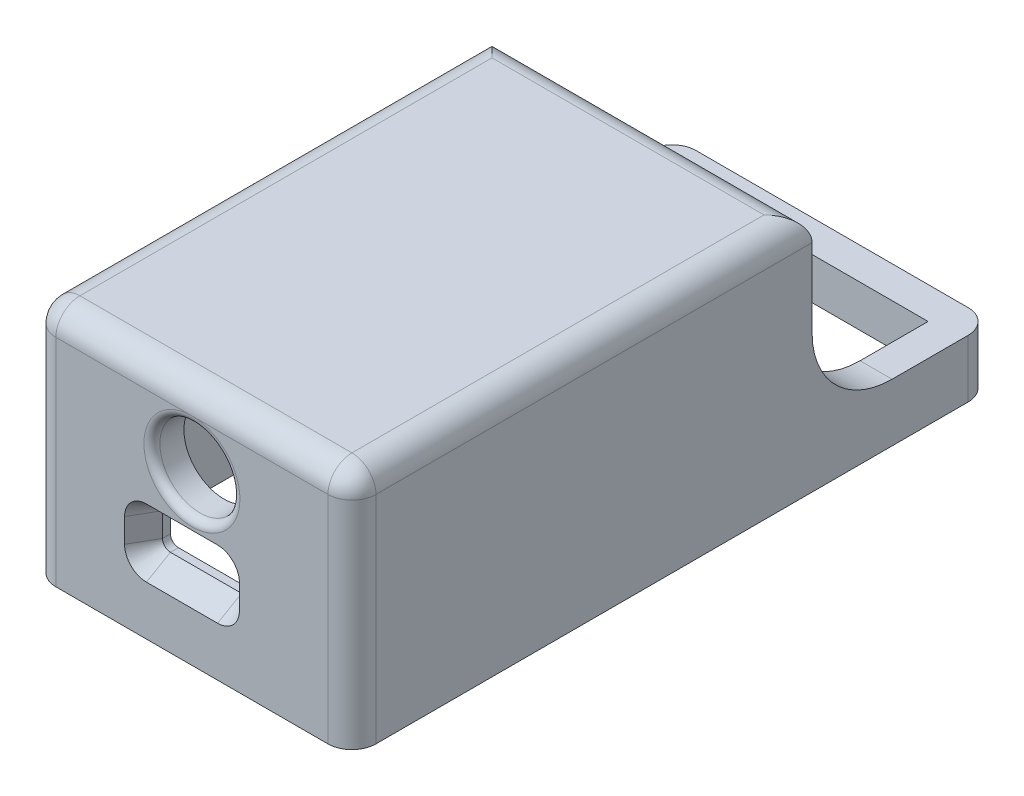
from build123d import *
from OCP.BRepFilletAPI import BRepFilletAPI_MakeChamfer

# Parameters (mm, degrees)
SKETCH1_W           = 40
SKETCH1_H           = 30.000000000000004
BOSS_EXTRUDE1_DEPTH = 80
SHELL1_T            = -4
SKETCH2_W           = 10.889999999999999
SKETCH2_H           = 5
CUT_EXTRUDE1_DEPTH  = 91.97252332435328
FILLET1_R           = 1
CHAMFER1_SIZE       = 3
CHAMFER1_SIZE2      = 1.732050807568882
CUT_EXTRUDE2_DEPTH  = 95.33981132056604
SKETCH4_R           = 5.000000000000001
CUT_EXTRUDE3_DEPTH  = 5
FILLET2_R           = 1
FILLET3_R           = 10
FILLET4_R           = 3
CUT_EXTRUDE4_DEPTH  = 2


with BuildPart() as part:
    # Sketch1 → Boss-Extrude1 (new body)
    with BuildSketch(Plane.XY):
        with Locations((20, 15.000000000000002)):
            Rectangle(SKETCH1_W, SKETCH1_H)
    extrude(amount=BOSS_EXTRUDE1_DEPTH)

    # Shell1
    shell1_openings = [part.faces().sort_by_distance(p)[0] for p in [
        (20, 0, 40),
    ]]
    offset(amount=SHELL1_T, openings=shell1_openings, kind=Kind.INTERSECTION)

    # Sketch2 → Cut-Extrude1 (cut, through all)
    with BuildSketch(Plane(origin=(0, 0, 76), x_dir=(-1, 0, 0), z_dir=(0, 0, -1))):
        with Locations((-18.76162487822802, 10.397683125280034)):
            Rectangle(SKETCH2_W, SKETCH2_H)
    extrude(amount=-CUT_EXTRUDE1_DEPTH, mode=Mode.SUBTRACT)

    # Fillet1
    fillet1_edges = [part.edges().sort_by_distance(p)[0] for p in [
        (13.316624878228021, 12.897683125280034, 78),
        (13.316624878228021, 7.897683125280034, 78),
        (24.206624878228023, 7.897683125280034, 78),
        (24.206624878228023, 12.897683125280034, 78),
    ]]
    fillet(fillet1_edges, radius=FILLET1_R)

    # Chamfer1: one chamfer whose edges measure the first distance from different faces: ONE call of the kernel's chamfer builder (chamfer() names one face for all edges)
    chamfer1_edges_1 = [part.edges().sort_by_distance(p)[0] for p in [
        (13.316624878228021, 10.397683125280034, 80),
    ]]
    chamfer1_side_1 = [part.faces().sort_by_distance(p)[0] for p in [
        (13.316624878228021, 10.397683125280034, 78),
    ]]
    chamfer1_edges_2 = [part.edges().sort_by_distance(p)[0] for p in [
        (18.761624878228023, 7.897683125280034, 80),
    ]]
    chamfer1_side_2 = [part.faces().sort_by_distance(p)[0] for p in [
        (18.761624878228023, 7.897683125280035, 78),
    ]]
    chamfer1_edges_3 = [part.edges().sort_by_distance(p)[0] for p in [
        (18.761624878228023, 12.897683125280034, 80),
    ]]
    chamfer1_side_3 = [part.faces().sort_by_distance(p)[0] for p in [
        (18.761624878228023, 12.897683125280034, 78),
    ]]
    chamfer1_edges_4 = [part.edges().sort_by_distance(p)[0] for p in [
        (24.206624878228023, 10.397683125280034, 80),
    ]]
    chamfer1_side_4 = [part.faces().sort_by_distance(p)[0] for p in [
        (24.206624878228023, 10.397683125280034, 78),
    ]]
    chamfer1_edges_5 = [part.edges().sort_by_distance(p)[0] for p in [
        (13.609518097041473, 8.190576344093486, 80),
    ]]
    chamfer1_side_5 = [part.faces().sort_by_distance(p)[0] for p in [
        (13.609518097041473, 8.190576344093486, 78),
    ]]
    chamfer1_edges_6 = [part.edges().sort_by_distance(p)[0] for p in [
        (13.609518097041473, 12.604789906466582, 80),
    ]]
    chamfer1_side_6 = [part.faces().sort_by_distance(p)[0] for p in [
        (13.609518097041473, 12.604789906466582, 78),
    ]]
    chamfer1_edges_7 = [part.edges().sort_by_distance(p)[0] for p in [
        (23.91373165941457, 8.190576344093486, 80),
    ]]
    chamfer1_side_7 = [part.faces().sort_by_distance(p)[0] for p in [
        (23.91373165941457, 8.190576344093486, 78),
    ]]
    chamfer1_edges_8 = [part.edges().sort_by_distance(p)[0] for p in [
        (23.91373165941457, 12.604789906466582, 80),
    ]]
    chamfer1_side_8 = [part.faces().sort_by_distance(p)[0] for p in [
        (23.91373165941457, 12.604789906466582, 78),
    ]]
    chamfer1 = BRepFilletAPI_MakeChamfer(part.part.solid().wrapped)
    for e in chamfer1_edges_1:
        chamfer1.Add(CHAMFER1_SIZE, CHAMFER1_SIZE2, e.wrapped, chamfer1_side_1[0].wrapped)  # the first distance lies on this face
    for e in chamfer1_edges_2:
        chamfer1.Add(CHAMFER1_SIZE, CHAMFER1_SIZE2, e.wrapped, chamfer1_side_2[0].wrapped)  # the first distance lies on this face
    for e in chamfer1_edges_3:
        chamfer1.Add(CHAMFER1_SIZE, CHAMFER1_SIZE2, e.wrapped, chamfer1_side_3[0].wrapped)  # the first distance lies on this face
    for e in chamfer1_edges_4:
        chamfer1.Add(CHAMFER1_SIZE, CHAMFER1_SIZE2, e.wrapped, chamfer1_side_4[0].wrapped)  # the first distance lies on this face
    for e in chamfer1_edges_5:
        chamfer1.Add(CHAMFER1_SIZE, CHAMFER1_SIZE2, e.wrapped, chamfer1_side_5[0].wrapped)  # the first distance lies on this face
    for e in chamfer1_edges_6:
        chamfer1.Add(CHAMFER1_SIZE, CHAMFER1_SIZE2, e.wrapped, chamfer1_side_6[0].wrapped)  # the first distance lies on this face
    for e in chamfer1_edges_7:
        chamfer1.Add(CHAMFER1_SIZE, CHAMFER1_SIZE2, e.wrapped, chamfer1_side_7[0].wrapped)  # the first distance lies on this face
    for e in chamfer1_edges_8:
        chamfer1.Add(CHAMFER1_SIZE, CHAMFER1_SIZE2, e.wrapped, chamfer1_side_8[0].wrapped)  # the first distance lies on this face
    add(Compound.cast(chamfer1.Shape()), mode=Mode.REPLACE)

    # Sketch3 → Cut-Extrude2 (cut, through all)
    with BuildSketch(Plane.ZY):
        Polygon((0, 30), (22.5, 30), (22.5, 7.220000000000001), (1.47e-15, 7.220000000000001), align=None)
    extrude(amount=-CUT_EXTRUDE2_DEPTH, mode=Mode.SUBTRACT)

    # Sketch4 → Cut-Extrude3 (cut)
    with BuildSketch(Plane.XY.offset(80)):
        with Locations((20, 20.999999999999996)):
            Circle(SKETCH4_R)
    extrude(amount=-CUT_EXTRUDE3_DEPTH, mode=Mode.SUBTRACT)

    # Fillet2
    fillet2_edges = [part.edges().sort_by_distance(p)[0] for p in [
        (15, 20.999999999999996, 80),
    ]]
    fillet(fillet2_edges, radius=FILLET2_R)

    # Fillet3
    fillet3_edges = [part.edges().sort_by_distance(p)[0] for p in [
        (2, 7.220000000000001, 22.5),
        (38, 7.220000000000001, 22.5),
    ]]
    fillet(fillet3_edges, radius=FILLET3_R)

    # Fillet4
    fillet4_edges = [part.edges().sort_by_distance(p)[0] for p in [
        (40, 15, 80),
        (20, 30, 80),
        (0, 15, 80),
        (40, 3.6100000000000003, 0),
        (0, 30, 51.25),
        (40, 30, 51.25),
        (0, 3.6099999999999994, 0),
        (20, 30, 22.5),
    ]]
    fillet(fillet4_edges, radius=FILLET4_R)

    # Sketch5 → Cut-Extrude4 (cut)
    with BuildSketch(Plane.XZ):
        with BuildLine():
            Line((36.65, 78.14999999999998), (3.3499999999999988, 78.14999999999998))
            ThreePointArc((3.3499999999999988, 78.14999999999998), (2.2893398282201787, 77.7106601717798), (1.8500000000000005, 76.64999999999998))
            Line((1.8500000000000005, 76.64999999999998), (1.8500000000000096, 3.350000000000001))
            ThreePointArc((1.8500000000000096, 3.350000000000001), (2.2893398282201884, 2.2893398282201796), (3.35000000000001, 1.850000000000001))
            Line((3.35000000000001, 1.850000000000001), (36.65, 1.8500000000000028))
            ThreePointArc((36.65, 1.8500000000000028), (37.71066017177982, 2.289339828220177), (38.150000000000006, 3.350000000000003))
            Line((38.150000000000006, 3.350000000000003), (38.150000000000006, 76.64999999999998))
            ThreePointArc((38.150000000000006, 76.64999999999998), (37.71066017177982, 77.7106601717798), (36.65, 78.14999999999998))
        make_face()
        Polygon((4, 76), (4.000000000000009, 4.000000000000001), (36.00000000000001, 4.000000000000003), (36.00000000000001, 76), align=None, mode=Mode.SUBTRACT)
    extrude(amount=-CUT_EXTRUDE4_DEPTH, mode=Mode.SUBTRACT)


solid = part.part
